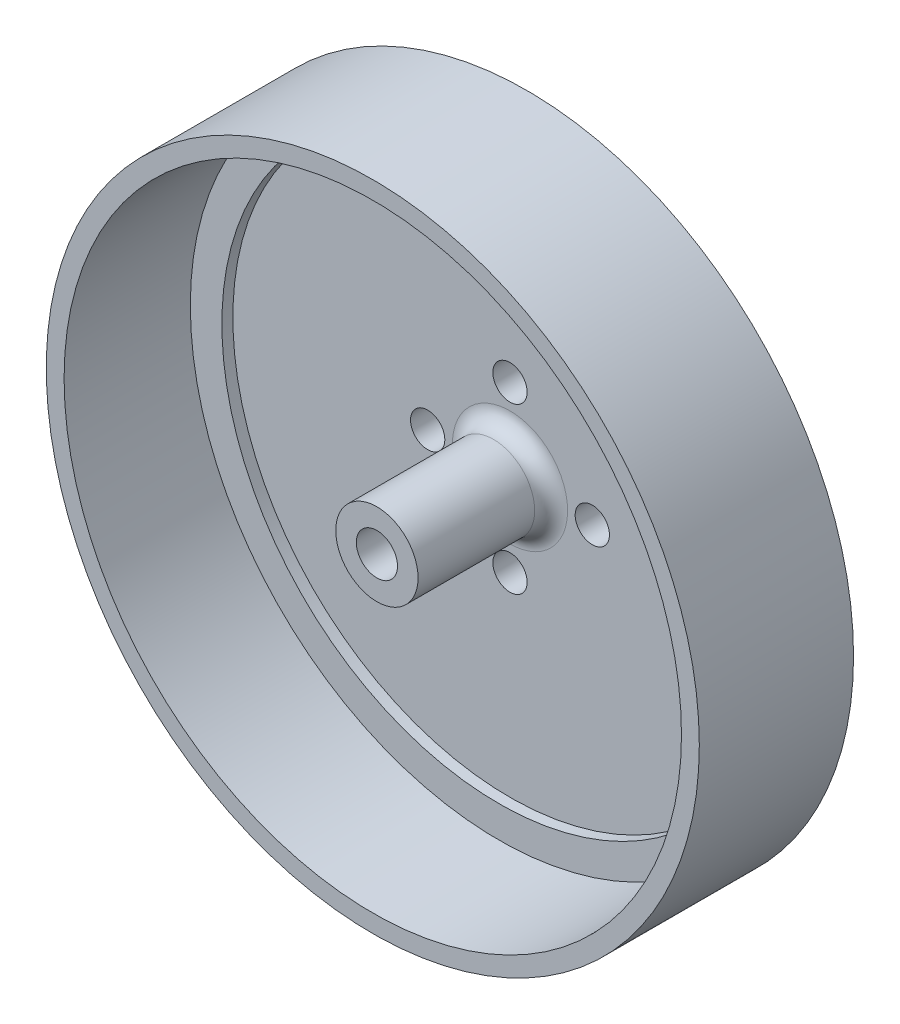
from build123d import *

# Parameters (mm, degrees)
SKETCH1_R               = 23.8
BOSS_EXTRUDE1_DEPTH     = 2.3
SKETCH2_R               = 23.8
SKETCH2_R_2             = 20.2
BOSS_EXTRUDE2_DEPTH     = 10
SKETCH3_R               = 3
BOSS_EXTRUDE3_DEPTH     = 9.7
CHAMFER1_SIZE           = 6
CHAMFER1_SIZE2          = 1.057961884
SKETCH4_R               = 1.25
CUT_EXTRUDE1_DEPTH      = 15
CUT_EXTRUDE3_START      = -9.2
SKETCH6_R               = 22.5
SKETCH6_R_2             = 20.2
CUT_EXTRUDE3_DEPTH      = 9.2
SKETCH7_R               = 1.5
CUT_EXTRUDE4_DEPTH      = 5
REDONDEO1_R             = 1.2
SALIENTE_EXTRUIR1_START = 1
CROQUIS1_R              = 9.339254136
CROQUIS1_R_2            = 1.25
SALIENTE_EXTRUIR1_DEPTH = 1
CROQUIS2_R              = 2
SALIENTE_EXTRUIR2_DEPTH = 3


with BuildPart() as part:
    # Sketch1 → Boss-Extrude1 (new body)
    with BuildSketch(Plane.XY):
        Circle(SKETCH1_R)
    extrude(amount=BOSS_EXTRUDE1_DEPTH)

    # Sketch2 → Boss-Extrude2 (add)
    with BuildSketch(Plane.XY.offset(2.3)):
        Circle(SKETCH2_R)
        Circle(SKETCH2_R_2, mode=Mode.SUBTRACT)
    extrude(amount=BOSS_EXTRUDE2_DEPTH)

    # Sketch3 → Boss-Extrude3 (add)
    with BuildSketch(Plane.XY.offset(2.3)):
        Circle(SKETCH3_R)
    extrude(amount=BOSS_EXTRUDE3_DEPTH)

    # Chamfer1
    chamfer1_edges = [part.edges().sort_by_distance(p)[0] for p in [
        (-23.8, 0, 0),
    ]]
    chamfer1_side = [part.faces().sort_by_distance(p)[0] for p in [
        (0, 0, 0),
    ]]
    chamfer(chamfer1_edges, length=CHAMFER1_SIZE, length2=CHAMFER1_SIZE2, reference=chamfer1_side[0])

    # Sketch4 → Cut-Extrude1 (cut)
    with BuildSketch(Plane(origin=(0, 0, 0), x_dir=(-1, 0, 0), z_dir=(0, 0, -1))):
        with Locations((6, 0)):
            Circle(SKETCH4_R)
        with Locations((0, -6)):
            Circle(SKETCH4_R)
        with Locations((-6, 0)):
            Circle(SKETCH4_R)
        with Locations((0, 6)):
            Circle(SKETCH4_R)
    extrude(amount=-CUT_EXTRUDE1_DEPTH, mode=Mode.SUBTRACT)

    # Sketch6 → Cut-Extrude3 (cut)
    with BuildSketch(Plane.XY.offset(12.3).offset(CUT_EXTRUDE3_START)):
        Circle(SKETCH6_R)
        Circle(SKETCH6_R_2, mode=Mode.SUBTRACT)
    extrude(amount=CUT_EXTRUDE3_DEPTH, mode=Mode.SUBTRACT)

    # Sketch7 → Cut-Extrude4 (cut)
    with BuildSketch(Plane.XY.offset(12)):
        Circle(SKETCH7_R)
    extrude(amount=-CUT_EXTRUDE4_DEPTH, mode=Mode.SUBTRACT)

    # Redondeo1
    redondeo1_edges = [part.edges().sort_by_distance(p)[0] for p in [
        (-3, 0, 2.3),
    ]]
    fillet(redondeo1_edges, radius=REDONDEO1_R)

    # Croquis1 → Saliente-Extruir1 (add)
    with BuildSketch(Plane(origin=(0, 0, 0), x_dir=(-1, 0, 0), z_dir=(0, 0, -1)).offset(SALIENTE_EXTRUIR1_START)):
        Circle(CROQUIS1_R)
        with Locations((0, 6)):
            Circle(CROQUIS1_R_2, mode=Mode.SUBTRACT)
        with Locations((6, 0)):
            Circle(CROQUIS1_R_2, mode=Mode.SUBTRACT)
        with Locations((0, -6)):
            Circle(CROQUIS1_R_2, mode=Mode.SUBTRACT)
        with Locations((-6, 0)):
            Circle(CROQUIS1_R_2, mode=Mode.SUBTRACT)
    extrude(amount=-SALIENTE_EXTRUIR1_DEPTH)

    # Croquis2 → Saliente-Extruir2 (add)
    with BuildSketch(Plane(origin=(0, 0, -1), x_dir=(-1, 0, 0), z_dir=(0, 0, -1))):
        Circle(CROQUIS2_R)
    extrude(amount=SALIENTE_EXTRUIR2_DEPTH)


solid = part.part
